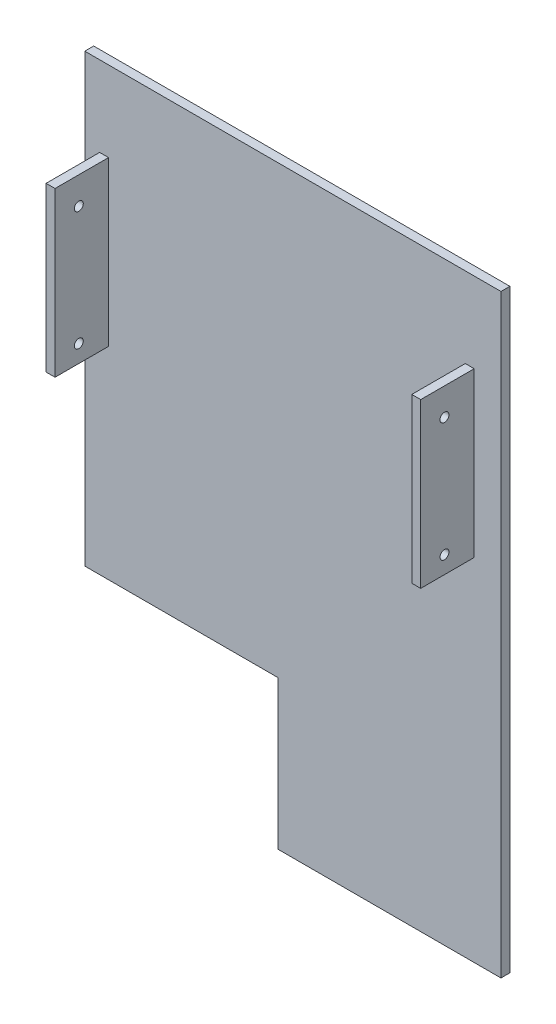
from build123d import *

# Parameters (mm, degrees)
SKETCH_1_W          = 140
SKETCH_1_H          = 200
EXTRUDE_1_DEPTH     = 3
SKETCH_2_W          = 65
SKETCH_2_H          = 50
CUT_EXTRUDE_1_DEPTH = 10
SKETCH_4_W          = 3
SKETCH_4_H          = 55
EXTRUDE_4_DEPTH     = 18
CUT_EXTRUDE_2_REACH = 244.211
SKETCH_5_R          = 1.5
SKETCH_6_W          = 18
SKETCH_6_H          = 55
SKETCH_6_R          = 1.5
EXTRUDE_6_DEPTH     = 3


with BuildPart() as part:
    # 草图1 → 凸台-拉伸1 (new body)
    with BuildSketch(Plane.XY):
        with Locations((70, -100)):
            Rectangle(SKETCH_1_W, SKETCH_1_H)
    extrude(amount=EXTRUDE_1_DEPTH)

    # 草图2 → 切除-拉伸1 (cut)
    with BuildSketch(Plane(origin=(0, 0, 0), x_dir=(-1, 0, 0), z_dir=(0, 0, -1))):
        with Locations((-32.5, -175)):
            Rectangle(SKETCH_2_W, SKETCH_2_H)
    extrude(amount=-CUT_EXTRUDE_1_DEPTH, mode=Mode.SUBTRACT)

    # 草图4 → 凸台-拉伸4 (add)
    with BuildSketch(Plane.XY.offset(3)):
        with Locations((6.5, -54.5)):
            Rectangle(SKETCH_4_W, SKETCH_4_H)
    extrude(amount=EXTRUDE_4_DEPTH)

    # 草图5 → 切除-拉伸2 (cut, up to next)
    with BuildSketch(Plane.ZY.offset(-5), mode=Mode.PRIVATE) as cut_extrude_2_sk1:
        with Locations(Location((13, -76.16447412, 0), (0, 0, 270))):
            Circle(SKETCH_5_R)
    cut_extrude_2_tool1 = extrude(cut_extrude_2_sk1.sketch, amount=-CUT_EXTRUDE_2_REACH, mode=Mode.PRIVATE) & part.part
    # 草图5 → 切除-拉伸2 (cut, up to next)
    with BuildSketch(Plane.ZY.offset(-5), mode=Mode.PRIVATE) as cut_extrude_2_sk2:
        with Locations(Location((13, -36.16447412, 0), (0, 0, 270))):
            Circle(SKETCH_5_R)
    cut_extrude_2_tool2 = extrude(cut_extrude_2_sk2.sketch, amount=-CUT_EXTRUDE_2_REACH, mode=Mode.PRIVATE) & part.part
    add(cut_extrude_2_tool1.solids().sort_by_distance((5, -76.164474, 13))[0], mode=Mode.SUBTRACT)
    add(cut_extrude_2_tool2.solids().sort_by_distance((5, -36.164474, 13))[0], mode=Mode.SUBTRACT)

    # 草图6 → 凸台-拉伸6 (add)
    with BuildSketch(Plane(origin=(128, 0, 0), x_dir=(0, 0, -1), z_dir=(1, 0, 0))):
        with Locations((-12, -54.5)):
            Rectangle(SKETCH_6_W, SKETCH_6_H)
        with Locations(Location((-13, -76.16447412, 0), (0, 0, 270))):
            Circle(SKETCH_6_R, mode=Mode.SUBTRACT)
        with Locations(Location((-13, -36.16447412, 0), (0, 0, 270))):
            Circle(SKETCH_6_R, mode=Mode.SUBTRACT)
    extrude(amount=EXTRUDE_6_DEPTH)


solid = part.part
